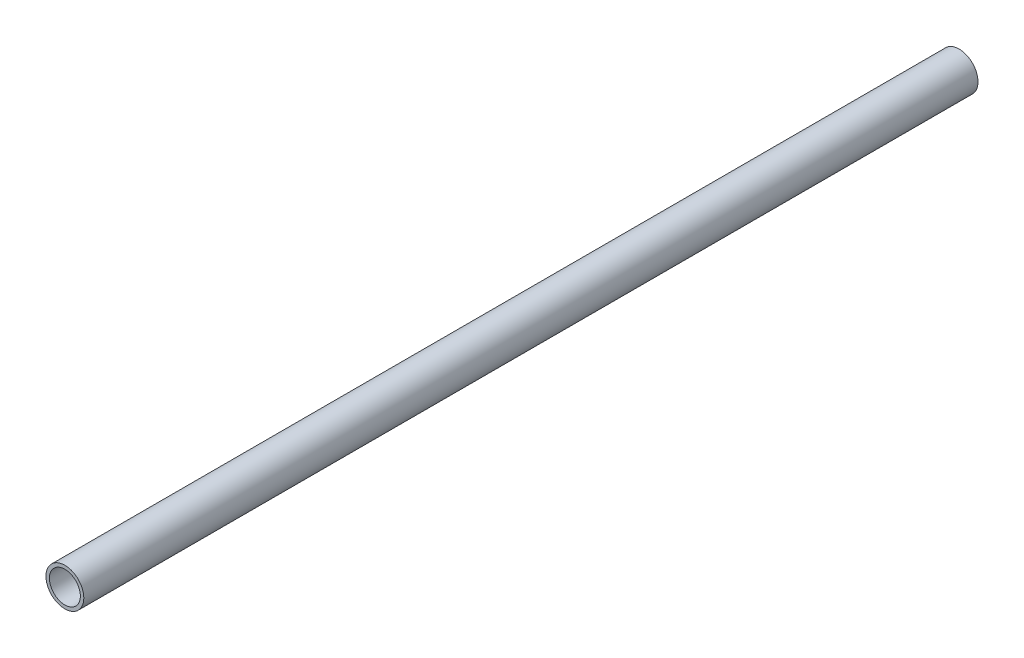
from build123d import *

# Parameters (mm, degrees)
ESQUISSE1_R        = 11
ESQUISSE1_R_2      = 9
BOSS_EXTRU_1_DEPTH = 520


with BuildPart() as part:
    # Esquisse1 → Boss.-Extru.1 (new body)
    with BuildSketch(Plane.XY):
        Circle(ESQUISSE1_R)
        Circle(ESQUISSE1_R_2, mode=Mode.SUBTRACT)
    extrude(amount=BOSS_EXTRU_1_DEPTH)


solid = part.part
